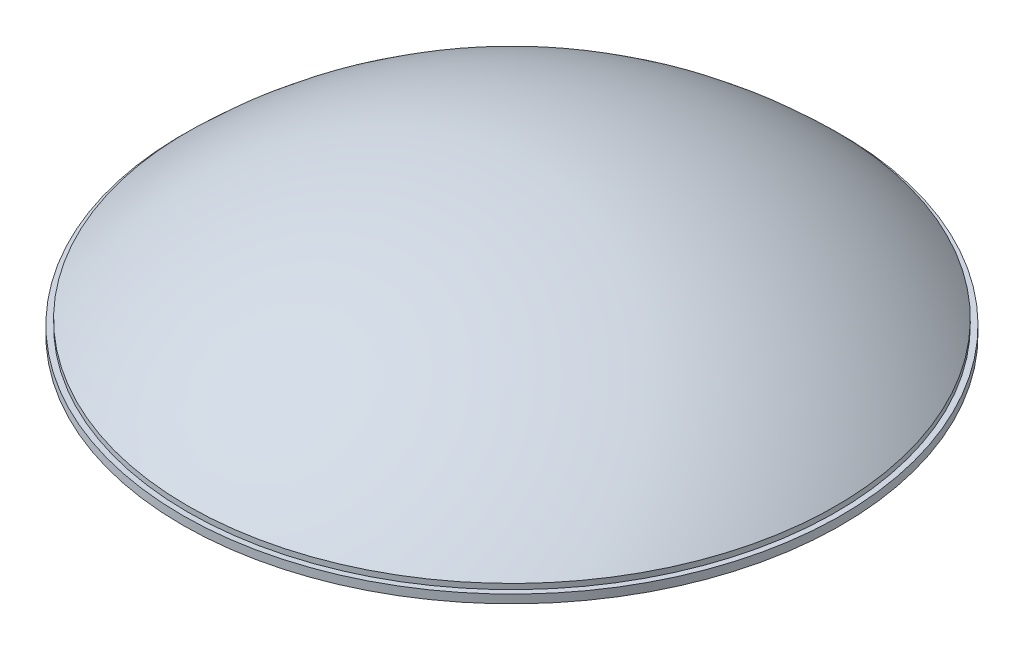
from build123d import *


with BuildPart() as part:
    # Sketch2 → Revolve1 (revolve)
    with BuildSketch(Plane(origin=(0, 0, 0), x_dir=(0, 0, -1), z_dir=(1, 0, 0)), mode=Mode.PRIVATE) as revolve1_sk:
        with BuildLine():
            Line((242.5, 236.958329575), (242.5, 241.159179796))
            Line((242.5, 241.159179796), (238.5, 241.159179796))
            Line((238.5, 241.159179796), (238.5, 245.115788965))
            ThreePointArc((238.5, 245.115788965), (128.713635979, 316.854540622), (0, 342))
            Line((0, 342), (0, 332))
            ThreePointArc((0, 332), (126.922374282, 306.781210159), (234.562648062, 234.9560898))
            Line((234.562648062, 234.9560898), (242.5, 234.9560898))
            Line((242.5, 234.9560898), (242.5, 236.958329575))
        make_face()
    revolve(revolve1_sk.sketch.rotate(Axis((0, 342, 0), (0, -1, 0)), 180), axis=Axis((0, 342, 0), (0, -1, 0)))


solid = part.part
